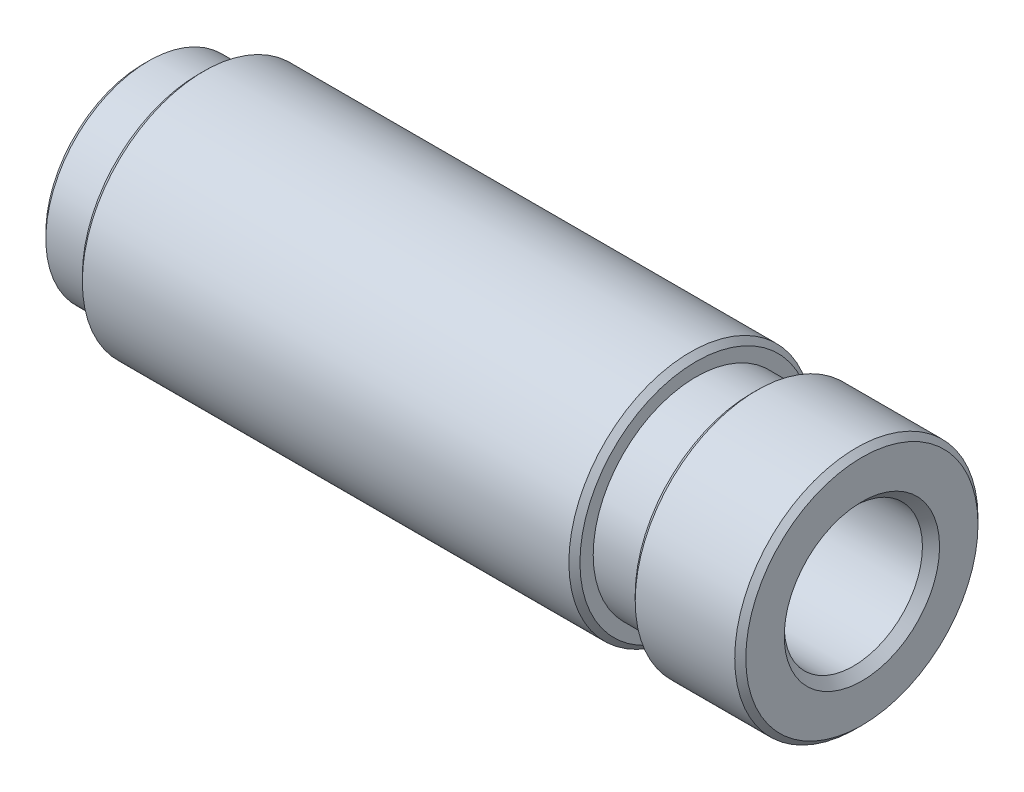
from build123d import *

# Parameters (mm, degrees)
FURO_ROSCADO_DE_M14X1_51_D           = 12.5
FURO_ROSCADO_DE_M14X1_51_DEPTH       = 32
FURO_ROSCADO_DE_M14X1_51_CSINK_D     = 14.05
FURO_ROSCADO_DE_M14X1_51_CSINK_ANGLE = 90
FURO_ROSCADO_DE_M14X1_51_TIP         = 3.755378869
FURO1_D                              = 10.65
FURO1_DEPTH                          = 33
CHANFRO1_SIZE                        = 0.5
FILETE1_R                            = 1.2
CHANFRO2_SIZE                        = 0.5


with BuildPart() as part:
    # Esboço1 → Revolução1 (revolve)
    with BuildSketch(Plane.XY, mode=Mode.PRIVATE) as revolu_o1_sk:
        Polygon((0, 0), (65, 0), (65, 11), (55, 11), (55, 9.3), (50, 9.3), (50, 11), (5, 11), (5, 9.3), (0, 9.3), align=None)
    revolve(revolu_o1_sk.sketch.rotate(Axis((0, 0, 0), (1, 0, 0)), 90), axis=Axis((0, 0, 0), (1, 0, 0)))

    # Furo roscado de M14x1.51
    with Locations(Plane(origin=(65, 0, 0), x_dir=(0, 0, -1), z_dir=(1, 0, 0))):
        with Locations((0, 0)):
            CounterSinkHole(FURO_ROSCADO_DE_M14X1_51_D / 2, FURO_ROSCADO_DE_M14X1_51_CSINK_D / 2, depth=FURO_ROSCADO_DE_M14X1_51_DEPTH, counter_sink_angle=FURO_ROSCADO_DE_M14X1_51_CSINK_ANGLE)
            with Locations((0, 0, -(FURO_ROSCADO_DE_M14X1_51_DEPTH + FURO_ROSCADO_DE_M14X1_51_TIP / 2))):  # 118° drill point
                Cone(0, FURO_ROSCADO_DE_M14X1_51_D / 2, FURO_ROSCADO_DE_M14X1_51_TIP, mode=Mode.SUBTRACT)

    # Furo1
    with Locations(Plane.ZY):
        with Locations((0, 0)):
            Hole(FURO1_D / 2, depth=FURO1_DEPTH)

    # Chanfro1
    chanfro1_edges = [part.edges().sort_by_distance(p)[0] for p in [
        (5, 0, -9.3),
        (5, 0, -11),
        (50, 0, -11),
    ]]
    chamfer(chanfro1_edges, length=CHANFRO1_SIZE)

    # Filete1
    filete1_edges = [part.edges().sort_by_distance(p)[0] for p in [
        (0, 0, 5.325),
    ]]
    fillet(filete1_edges, radius=FILETE1_R)

    # Chanfro2
    chanfro2_edges = [part.edges().sort_by_distance(p)[0] for p in [
        (65, 0, -11),
        (0, 0, -9.3),
        (55, 0, -11),
    ]]
    chamfer(chanfro2_edges, length=CHANFRO2_SIZE)


solid = part.part
